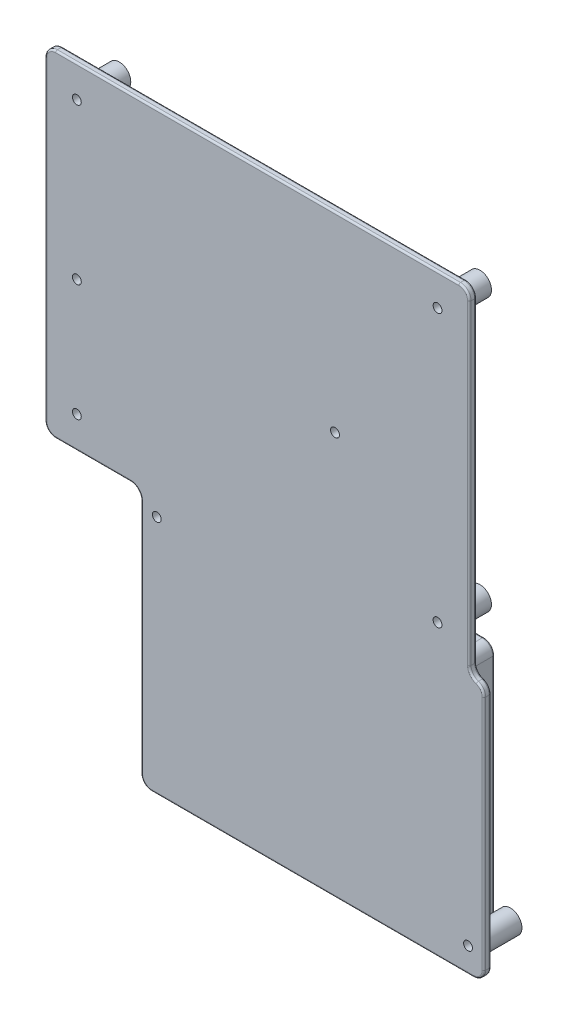
from build123d import *

# Parameters (mm, degrees)
BOSS_EXTRUDE1_START = 10
SKETCH1_W           = 120
SKETCH1_H           = 95
SKETCH1_R           = 3.25
SKETCH1_R_2         = 1.25
SKETCH1_W_2         = 12.958261818
SKETCH1_H_2         = 72.881820619
SKETCH1_W_3         = 53.307083162
SKETCH1_W_4         = 12.73465502
SKETCH1_W_5         = 9
BOSS_EXTRUDE1_DEPTH = 2
SKETCH1_3_R         = 3.25
SKETCH1_3_R_2       = 1.25
SKETCH1_3_W         = 12.73465502
SKETCH1_3_H         = 72.881820619
SKETCH1_3_W_2       = 12.958261818
BOSS_EXTRUDE2_DEPTH = 10
FILLET1_R           = 3
FILLET2_R           = 3
FILLET3_R           = 0.5


with BuildPart() as part:
    # Sketch1 → Boss-Extrude1 (new body)
    # profile 1 of 14: a face of its own
    with BuildSketch(Plane.XY.offset(BOSS_EXTRUDE1_START)):
        with Locations((-105, -92.5)):
            Rectangle(SKETCH1_W, SKETCH1_H)
        with Locations((-83, -99)):
            Circle(SKETCH1_R, mode=Mode.SUBTRACT)
        with Locations((-54, -131)):
            Circle(SKETCH1_R, mode=Mode.SUBTRACT)
        with Locations((-156, -131)):
            Circle(SKETCH1_R, mode=Mode.SUBTRACT)
        with Locations((-156, -98)):
            Circle(SKETCH1_R, mode=Mode.SUBTRACT)
        with Locations((-156, -54)):
            Circle(SKETCH1_R, mode=Mode.SUBTRACT)
        with Locations((-54, -54)):
            Circle(SKETCH1_R, mode=Mode.SUBTRACT)
    # profile 2 of 14: a face of its own
    with BuildSketch(Plane.XY.offset(BOSS_EXTRUDE1_START)):
        with Locations((-54, -54)):
            Circle(SKETCH1_R)
        with Locations((-54, -54)):
            Circle(SKETCH1_R_2, mode=Mode.SUBTRACT)
    # profile 3 of 14: a face of its own
    with BuildSketch(Plane.XY.offset(BOSS_EXTRUDE1_START)):
        with Locations((-156, -54)):
            Circle(SKETCH1_R)
        with Locations((-156, -54)):
            Circle(SKETCH1_R_2, mode=Mode.SUBTRACT)
    # profile 4 of 14: a face of its own
    with BuildSketch(Plane.XY.offset(BOSS_EXTRUDE1_START)):
        with Locations((-156, -98)):
            Circle(SKETCH1_R)
        with Locations((-156, -98)):
            Circle(SKETCH1_R_2, mode=Mode.SUBTRACT)
    # profile 5 of 14: a face of its own
    with BuildSketch(Plane.XY.offset(BOSS_EXTRUDE1_START)):
        with Locations((-83, -99)):
            Circle(SKETCH1_R)
        with Locations((-83, -99)):
            Circle(SKETCH1_R_2, mode=Mode.SUBTRACT)
    # profile 6 of 14: a face of its own
    with BuildSketch(Plane.XY.offset(BOSS_EXTRUDE1_START)):
        with Locations((-156, -131)):
            Circle(SKETCH1_R)
        with Locations((-156, -131)):
            Circle(SKETCH1_R_2, mode=Mode.SUBTRACT)
    # profile 7 of 14: a face of its own
    with BuildSketch(Plane.XY.offset(BOSS_EXTRUDE1_START)):
        with Locations((-54, -131)):
            Circle(SKETCH1_R)
        with Locations((-54, -131)):
            Circle(SKETCH1_R_2, mode=Mode.SUBTRACT)
    # profile 8 of 14: a face of its own
    with BuildSketch(Plane.XY.offset(BOSS_EXTRUDE1_START)):
        Polygon((-49.881820619, -212.881820619), (-40.881820619, -212.881820619), (-40.881820619, -140), (-45, -140), (-49.881820619, -140), align=None)
        with Locations((-45.381820619, -205.881820619)):
            Circle(SKETCH1_R, mode=Mode.SUBTRACT)
    # profile 9 of 14: a face of its own
    with BuildSketch(Plane.XY.offset(BOSS_EXTRUDE1_START)):
        with Locations((-56.360951528, -176.440910309)):
            Rectangle(SKETCH1_W_2, SKETCH1_H_2)
    # profile 10 of 14: a face of its own
    with BuildSketch(Plane.XY.offset(BOSS_EXTRUDE1_START)):
        with Locations((-89.493624018, -176.440910309)):
            Rectangle(SKETCH1_W_3, SKETCH1_H_2)
    # profile 11 of 14: a face of its own
    with BuildSketch(Plane.XY.offset(BOSS_EXTRUDE1_START)):
        with Locations((-122.514493109, -176.440910309)):
            Rectangle(SKETCH1_W_4, SKETCH1_H_2)
    # profile 12 of 14: a face of its own
    with BuildSketch(Plane.XY.offset(BOSS_EXTRUDE1_START)):
        with Locations((-133.381820619, -176.440910309)):
            Rectangle(SKETCH1_W_5, SKETCH1_H_2)
        with Locations((-133.381820619, -144.881820619)):
            Circle(SKETCH1_R, mode=Mode.SUBTRACT)
    # profile 13 of 14: a face of its own
    with BuildSketch(Plane.XY.offset(BOSS_EXTRUDE1_START)):
        with Locations((-133.381820619, -144.881820619)):
            Circle(SKETCH1_R)
        with Locations((-133.381820619, -144.881820619)):
            Circle(SKETCH1_R_2, mode=Mode.SUBTRACT)
    # profile 14 of 14: a face of its own
    with BuildSketch(Plane.XY.offset(BOSS_EXTRUDE1_START)):
        with Locations((-45.381820619, -205.881820619)):
            Circle(SKETCH1_R)
        with Locations((-45.381820619, -205.881820619)):
            Circle(SKETCH1_R_2, mode=Mode.SUBTRACT)
    extrude(amount=BOSS_EXTRUDE1_DEPTH)

    # Sketch1<3> → Boss-Extrude2 (add)
    # profile 1 of 10: a face of its own
    with BuildSketch(Plane.XY):
        with Locations((-54, -131)):
            Circle(SKETCH1_3_R)
        with Locations((-54, -131)):
            Circle(SKETCH1_3_R_2, mode=Mode.SUBTRACT)
    # profile 2 of 10: a face of its own
    with BuildSketch(Plane.XY):
        with Locations((-83, -99)):
            Circle(SKETCH1_3_R)
        with Locations((-83, -99)):
            Circle(SKETCH1_3_R_2, mode=Mode.SUBTRACT)
    # profile 3 of 10: a face of its own
    with BuildSketch(Plane.XY):
        with Locations((-54, -54)):
            Circle(SKETCH1_3_R)
        with Locations((-54, -54)):
            Circle(SKETCH1_3_R_2, mode=Mode.SUBTRACT)
    # profile 4 of 10: a face of its own
    with BuildSketch(Plane.XY):
        with Locations((-156, -54)):
            Circle(SKETCH1_3_R)
        with Locations((-156, -54)):
            Circle(SKETCH1_3_R_2, mode=Mode.SUBTRACT)
    # profile 5 of 10: a face of its own
    with BuildSketch(Plane.XY):
        with Locations((-156, -98)):
            Circle(SKETCH1_3_R)
        with Locations((-156, -98)):
            Circle(SKETCH1_3_R_2, mode=Mode.SUBTRACT)
    # profile 6 of 10: a face of its own
    with BuildSketch(Plane.XY):
        with Locations((-156, -131)):
            Circle(SKETCH1_3_R)
        with Locations((-156, -131)):
            Circle(SKETCH1_3_R_2, mode=Mode.SUBTRACT)
    # profile 7 of 10: a face of its own
    with BuildSketch(Plane.XY):
        with Locations((-133.381820619, -144.881820619)):
            Circle(SKETCH1_3_R)
        with Locations((-133.381820619, -144.881820619)):
            Circle(SKETCH1_3_R_2, mode=Mode.SUBTRACT)
    # profile 8 of 10: a face of its own
    with BuildSketch(Plane.XY):
        with Locations((-122.514493109, -176.440910309)):
            Rectangle(SKETCH1_3_W, SKETCH1_3_H)
    # profile 9 of 10: a face of its own
    with BuildSketch(Plane.XY):
        with Locations((-56.360951528, -176.440910309)):
            Rectangle(SKETCH1_3_W_2, SKETCH1_3_H)
    # profile 10 of 10: a face of its own
    with BuildSketch(Plane.XY):
        with Locations((-45.381820619, -205.881820619)):
            Circle(SKETCH1_3_R)
        with Locations((-45.381820619, -205.881820619)):
            Circle(SKETCH1_3_R_2, mode=Mode.SUBTRACT)
    extrude(amount=BOSS_EXTRUDE2_DEPTH)

    # Fillet1
    fillet1_edges = [part.edges().sort_by_distance(p)[0] for p in [
        (-128.881820619, -212.881820619, 5),
        (-128.881820619, -140, 5),
        (-116.147165599, -140, 5),
        (-116.147165599, -212.881820619, 5),
        (-49.881820619, -140, 5),
        (-62.840082437, -140, 5),
        (-62.840082437, -212.881820619, 5),
        (-49.881820619, -212.881820619, 5),
        (-137.881820619, -140, 11),
        (-165, -140, 11),
        (-165, -45, 11),
        (-45, -45, 11),
        (-40.881820619, -140, 11),
        (-40.881820619, -212.881820619, 11),
        (-137.881820619, -212.881820619, 11),
    ]]
    fillet(fillet1_edges, radius=FILLET1_R)

    # Fillet2
    fillet2_edges = [part.edges().sort_by_distance(p)[0] for p in [
        (-45, -140, 11),
    ]]
    fillet(fillet2_edges, radius=FILLET2_R)

    # Fillet3
    fillet3_edges = [part.edges().sort_by_distance(p)[0] for p in [
        (-89.493624018, -212.881820619, 10),
        (-137.881820619, -176.44091031, 10),
        (-137.881820619, -176.44091031, 12),
        (-151.44091031, -140, 10),
        (-151.44091031, -140, 12),
        (-105, -45, 10),
        (-105, -45, 12),
        (-165, -92.5, 10),
        (-45, -92.651370893, 10),
        (-40.881820619, -176.44091031, 10),
        (-48.381820619, -212.881820619, 10),
        (-41.760500276, -212.003140963, 10),
        (-137.003140963, -212.003140963, 10),
        (-164.121320344, -139.121320344, 10),
        (-164.121320344, -45.878679656, 10),
        (-45.878679656, -45.878679656, 10),
        (-45, -92.651370893, 12),
        (-89.381820619, -212.881820619, 12),
        (-40.881820619, -176.44091031, 12),
        (-165, -92.5, 12),
        (-41.760500276, -212.003140963, 12),
        (-137.003140963, -212.003140963, 12),
        (-41.450490641, -141.242548853, 12),
        (-164.121320344, -139.121320344, 12),
        (-164.121320344, -45.878679656, 12),
        (-45.878679656, -45.878679656, 12),
        (-128.881820619, -176.44091031, 0),
        (-116.147165599, -176.44091031, 0),
        (-122.514493109, -212.881820619, 0),
        (-122.514493109, -140, 0),
        (-117.025845255, -212.003140963, 0),
        (-128.003140963, -212.003140963, 0),
        (-117.025845255, -140.878679656, 0),
        (-128.003140963, -140.878679656, 0),
        (-62.840082437, -176.44091031, 0),
        (-56.360951528, -140, 0),
        (-49.881820619, -176.44091031, 0),
        (-56.360951528, -212.881820619, 0),
        (-50.760500276, -212.003140963, 0),
        (-61.961402781, -212.003140963, 0),
        (-50.760500276, -140.878679656, 0),
        (-61.961402781, -140.878679656, 0),
        (-138.760500276, -140.878679656, 10),
        (-138.760500276, -140.878679656, 12),
        (-41.450490641, -141.242548853, 10),
        (-44.431329979, -139.060192933, 10),
        (-44.431329979, -139.060192933, 12),
        (-130.381820619, -212.881820619, 10),
    ]]
    fillet(fillet3_edges, radius=FILLET3_R)


solid = part.part
